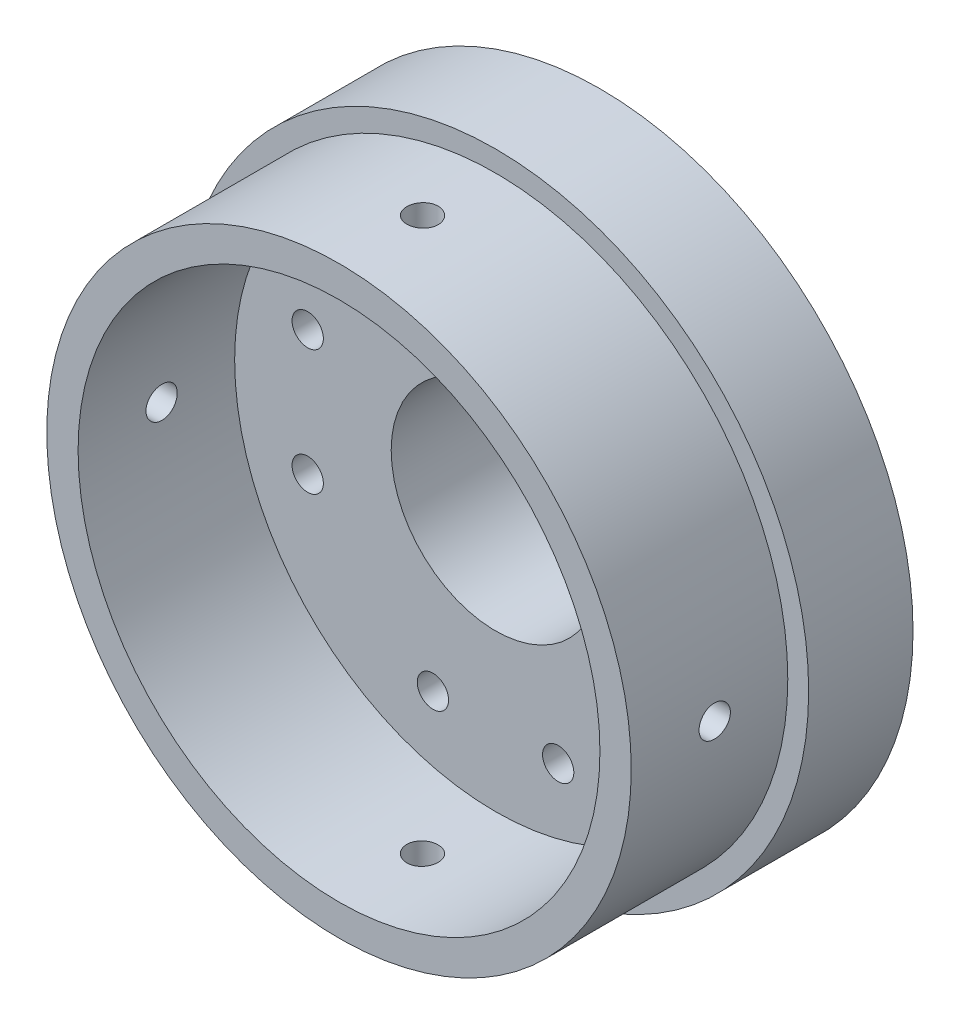
from build123d import *

# Parameters (mm, degrees)
SKETCH_1_R               = 30
EXTRUDE_1_DEPTH          = 10
SKETCH_2_R               = 28
SKETCH_2_R_2             = 25
EXTRUDE_2_DEPTH          = 15
CUT_EXTRUDE_1_DEPTH      = 72.589105316
CUT_EXTRUDE_1_DEPTH_BACK = 72.589105316
SKETCH_3_R               = 1.5
CUT_EXTRUDE_2_DEPTH      = 70.094138717
CUT_EXTRUDE_2_DEPTH_BACK = 70.094138717
SKETCH_4_R               = 1.5
SKETCH_5_R               = 1.5
CUT_EXTRUDE_3_DEPTH      = 15
SKETCH_6_R               = 10
CUT_EXTRUDE_4_DEPTH      = 10


with BuildPart() as part:
    # 스케치1 → 보스-돌출1 (new body)
    with BuildSketch(Plane.XY):
        Circle(SKETCH_1_R)
    extrude(amount=EXTRUDE_1_DEPTH)

    # 스케치2 → 보스-돌출2 (add)
    with BuildSketch(Plane.XY.offset(10)):
        Circle(SKETCH_2_R)
        Circle(SKETCH_2_R_2, mode=Mode.SUBTRACT)
    extrude(amount=EXTRUDE_2_DEPTH)

    # 스케치3 → 컷-돌출1 (cut, two sides: drawn at the far end of the back side and taken through both)
    with BuildSketch(Plane(origin=(0, 30, 0), x_dir=(1, 0, 0), z_dir=(0, 1, 0)).offset(-CUT_EXTRUDE_1_DEPTH_BACK)):
        with Locations(Location((0, -17, 0), (0, 0, 180))):
            Circle(SKETCH_3_R)
    extrude(amount=CUT_EXTRUDE_1_DEPTH + CUT_EXTRUDE_1_DEPTH_BACK, mode=Mode.SUBTRACT)

    # 스케치4 → 컷-돌출2 (cut, two sides: drawn at the far end of the back side and taken through both)
    with BuildSketch(Plane.ZY.offset(27).offset(-CUT_EXTRUDE_2_DEPTH_BACK)):
        with Locations(Location((17, 0, 0), (0, 0, 270))):
            Circle(SKETCH_4_R)
    extrude(amount=CUT_EXTRUDE_2_DEPTH + CUT_EXTRUDE_2_DEPTH_BACK, mode=Mode.SUBTRACT)

    # 스케치5 → 컷-돌출3 (cut)
    with BuildSketch(Plane(origin=(0, 0, 0), x_dir=(-1, 0, 0), z_dir=(0, 0, -1))):
        with Locations((-6, -18)):
            Circle(SKETCH_5_R)
        with Locations((6, -18)):
            Circle(SKETCH_5_R)
        with Locations((18, -6)):
            Circle(SKETCH_5_R)
        with Locations((18, 6)):
            Circle(SKETCH_5_R)
        with Locations((6, 18)):
            Circle(SKETCH_5_R)
        with Locations((-6, 18)):
            Circle(SKETCH_5_R)
        with Locations((-18, 6)):
            Circle(SKETCH_5_R)
        with Locations((-18, -6)):
            Circle(SKETCH_5_R)
    extrude(amount=-CUT_EXTRUDE_3_DEPTH, mode=Mode.SUBTRACT)

    # 스케치6 → 컷-돌출4 (cut)
    with BuildSketch(Plane(origin=(0, 0, 0), x_dir=(-1, 0, 0), z_dir=(0, 0, -1))):
        Circle(SKETCH_6_R)
    extrude(amount=-CUT_EXTRUDE_4_DEPTH, mode=Mode.SUBTRACT)


solid = part.part
